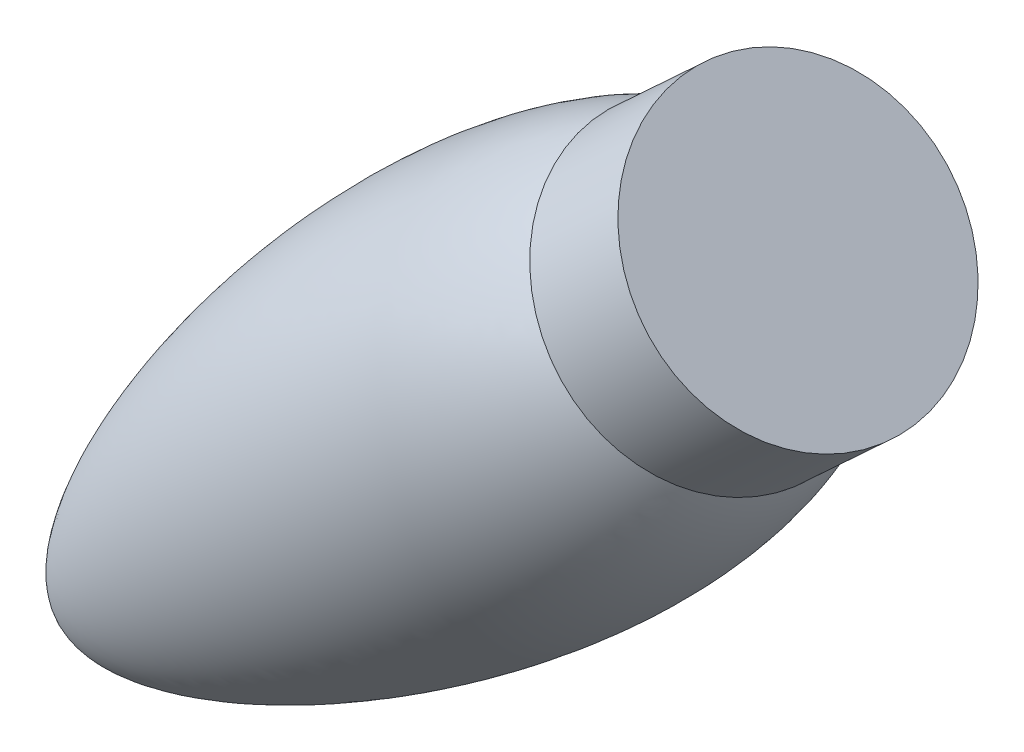
from build123d import *

# Parameters (mm, degrees)
SKETCH_2_R      = 6.204053242
EXTRUDE_1_DEPTH = 5


with BuildPart() as part:
    # 草圖1 → 旋轉1 (revolve)
    with BuildSketch(Plane.XY):
        with BuildLine():
            Line((-23.337010244, 14.532218953), (-26.56652355, 3.24092676))
            Line((-26.56652355, 3.24092676), (-45.341799777, -14.140886349))
            add(Edge.make_bspline(
                [(-23.337010244, 14.532218953), (-35.104460313, 9.817756382), (-48.623794714, -11.063163036), (-45.341799777, -14.140886349)],
                knots=[0, 0, 0, 0, 0.692190339, 0.692190339, 0.692190339, 0.692190339], degree=3))
        make_face()
    revolve(axis=Axis((-26.56652355, 3.24092676, 0), (-0.7338133167062407, -0.6793511729765295, 0)))


with BuildPart() as body_2:
    # 草圖2 → 填料-伸長1 (new body)
    with BuildSketch(Plane(origin=(-5.322002285, -4.927014014, 0), x_dir=(0, 0, 1), z_dir=(-0.7338133167062408, -0.6793511729765294, 0))):
        with Locations(Location((0, 20.53856047, 0), (0, 0, 270))):
            Circle(SKETCH_2_R)
    extrude(amount=-EXTRUDE_1_DEPTH)


solid = Compound([part.part, body_2.part])
